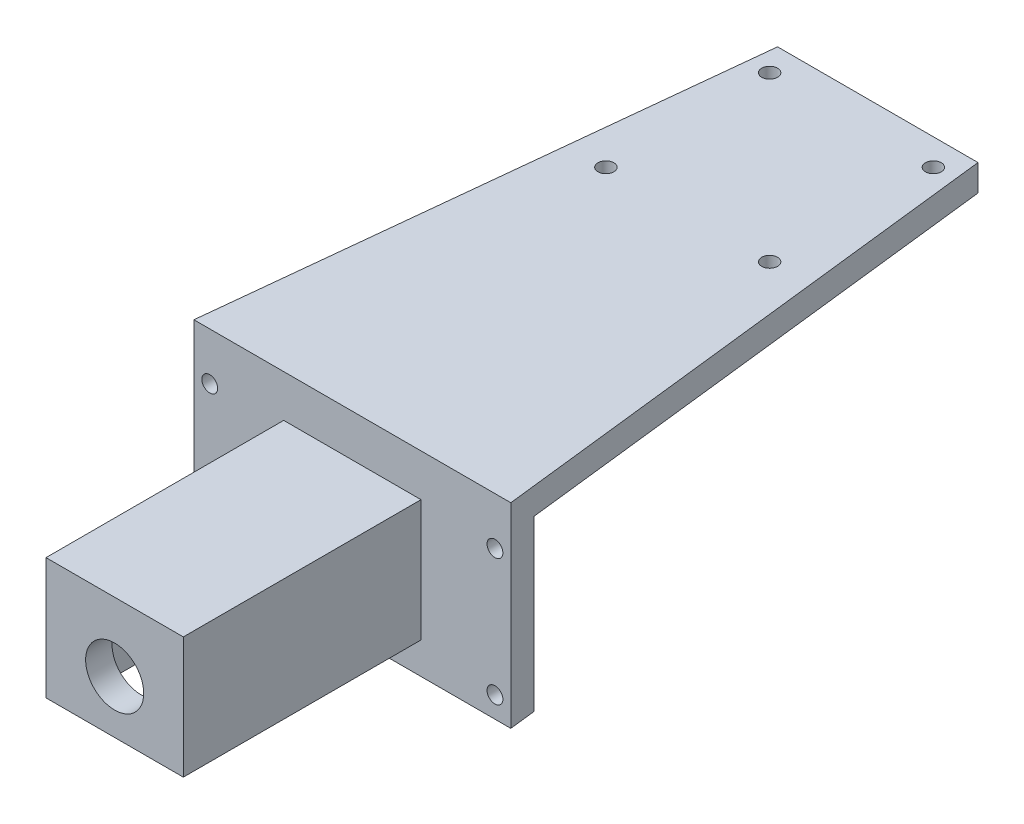
from build123d import *

# Parameters (mm, degrees)
SKETCH1_W           = 60
SKETCH1_H           = 32
BOSS_EXTRUDE1_DEPTH = 5
SKETCH2_R           = 1.5
CUT_EXTRUDE1_DEPTH  = 5
SKETCH4_R           = 5
CUT_EXTRUDE2_DEPTH  = 5
SKETCH5_W           = 60
SKETCH5_H           = 5
BOSS_EXTRUDE2_DEPTH = 100
SKETCH6_R           = 1.5
CUT_EXTRUDE3_DEPTH  = 100
CUT_EXTRUDE4_DEPTH  = 100
BOSS_EXTRUDE3_DEPTH = 45
SKETCH9_W           = 26
SKETCH9_H           = 23
BOSS_EXTRUDE4_DEPTH = 5
SKETCH10_R          = 5.5
CUT_EXTRUDE5_DEPTH  = 5


with BuildPart() as part:
    # Sketch1 → Boss-Extrude1 (new body)
    with BuildSketch(Plane.XY):
        Rectangle(SKETCH1_W, SKETCH1_H)
    extrude(amount=BOSS_EXTRUDE1_DEPTH)

    # Sketch2 → Cut-Extrude1 (cut)
    with BuildSketch(Plane.XY.offset(5)):
        with Locations((27, 12)):
            Circle(SKETCH2_R)
        with Locations((27, -12)):
            Circle(SKETCH2_R)
        with Locations((-27, -12)):
            Circle(SKETCH2_R)
        with Locations((-27, 12)):
            Circle(SKETCH2_R)
    extrude(amount=-CUT_EXTRUDE1_DEPTH, mode=Mode.SUBTRACT)

    # Sketch4 → Cut-Extrude2 (cut)
    with BuildSketch(Plane.XY.offset(5)):
        Circle(SKETCH4_R)
    extrude(amount=-CUT_EXTRUDE2_DEPTH, mode=Mode.SUBTRACT)

    # Sketch5 → Boss-Extrude2 (add)
    with BuildSketch(Plane.XY.offset(5)):
        with Locations((0, 18.5)):
            Rectangle(SKETCH5_W, SKETCH5_H)
    extrude(amount=-BOSS_EXTRUDE2_DEPTH)

    # Sketch6 → Cut-Extrude3 (cut)
    with BuildSketch(Plane.XZ.offset(-16)):
        with Locations(Location((15, -59, 0), (0, 0, 270))):
            Circle(SKETCH6_R)
        with Locations(Location((-16, -59, 0), (0, 0, 270))):
            Circle(SKETCH6_R)
        with Locations(Location((15, -90, 0), (0, 0, 270))):
            Circle(SKETCH6_R)
        with Locations(Location((-16, -90, 0), (0, 0, 270))):
            Circle(SKETCH6_R)
    extrude(amount=-CUT_EXTRUDE3_DEPTH, mode=Mode.SUBTRACT)

    # Sketch7 → Cut-Extrude4 (cut)
    with BuildSketch(Plane(origin=(0, 21, 0), x_dir=(1, 0, 0), z_dir=(0, 1, 0))):
        Polygon((30, -5), (18.449048919, 95), (30, 95), align=None)
        Polygon((-30, -5), (-19.496844987, 95), (-30, 95), align=None)
    extrude(amount=-CUT_EXTRUDE4_DEPTH, mode=Mode.SUBTRACT)

    # Sketch8 → Boss-Extrude3 (add)
    with BuildSketch(Plane.XY.offset(5)):
        Polygon((13, 13), (-13, 13), (-13, -10), (-10, -10), (-10, 10), (10, 10), (10, -10), (13, -10), align=None)
    extrude(amount=BOSS_EXTRUDE3_DEPTH)

    # Sketch9 → Boss-Extrude4 (add)
    with BuildSketch(Plane.XY.offset(50)):
        with Locations((0, 1.5)):
            Rectangle(SKETCH9_W, SKETCH9_H)
    extrude(amount=-BOSS_EXTRUDE4_DEPTH)

    # Sketch10 → Cut-Extrude5 (cut)
    with BuildSketch(Plane.XY.offset(50)):
        Circle(SKETCH10_R)
    extrude(amount=-CUT_EXTRUDE5_DEPTH, mode=Mode.SUBTRACT)


solid = part.part
